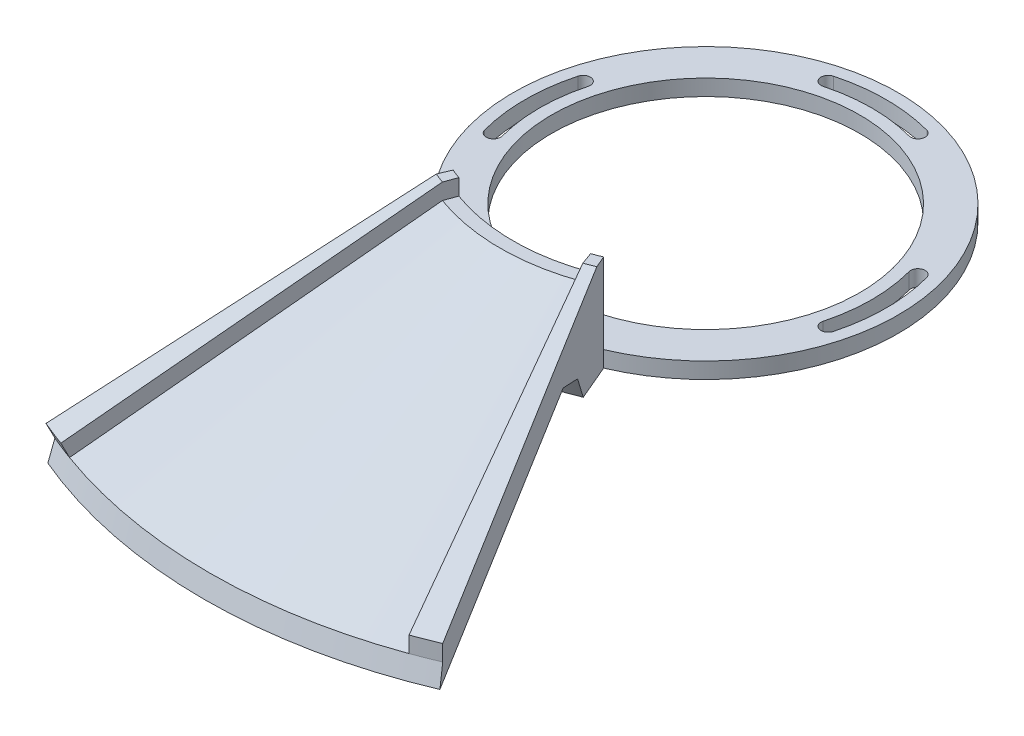
from build123d import *

# Parameters (mm, degrees)
SCHIZZO1_R                   = 60
SCHIZZO1_R_2                 = 48
ESTRUSIONE_ESTRUSIONE1_DEPTH = 5
RIVOLUZIONE1_ANGLE           = 23
RIVOLUZIONE1_OTHER_WAY_ANGLE = 23
RIVOLUZIONE2_ANGLE           = 3
RIVOLUZIONE3_ANGLE           = 3


with BuildPart() as part:
    # Schizzo1 → Estrusione-Estrusione1 (new body)
    with BuildSketch(Plane(origin=(0, 0, 0), x_dir=(1, 0, 0), z_dir=(0, 1, 0))):
        with Locations(Location((0, 0, 0), (0, 0, 270))):
            Circle(SCHIZZO1_R)
        with Locations(Location((0, 0, 0), (0, 0, 270))):
            Circle(SCHIZZO1_R_2, mode=Mode.SUBTRACT)
        with BuildLine():
            ThreePointArc((-14.558571287, -54.333327729), (0, -56.25), (14.558571287, -54.333327729))
            ThreePointArc((14.558571287, -54.333327729), (16.149561545, -51.577651768), (13.393885584, -49.98666151))
            ThreePointArc((13.393885584, -49.98666151), (0, -51.75), (-13.393885584, -49.98666151))
            ThreePointArc((-13.393885584, -49.98666151), (-16.149561545, -51.577651768), (-14.558571287, -54.333327729))
        make_face(mode=Mode.SUBTRACT)
        with BuildLine():
            ThreePointArc((13.393885584, 49.98666151), (16.149561545, 51.577651768), (14.558571287, 54.333327729))
            ThreePointArc((14.558571287, 54.333327729), (0, 56.25), (-14.558571287, 54.333327729))
            ThreePointArc((-14.558571287, 54.333327729), (-16.149561545, 51.577651768), (-13.393885584, 49.98666151))
            ThreePointArc((-13.393885584, 49.98666151), (0, 51.75), (13.393885584, 49.98666151))
        make_face(mode=Mode.SUBTRACT)
        with BuildLine():
            ThreePointArc((49.98666151, -13.393885584), (51.577651768, -16.149561545), (54.333327729, -14.558571287))
            ThreePointArc((54.333327729, -14.558571287), (56.25, 0), (54.333327729, 14.558571287))
            ThreePointArc((54.333327729, 14.558571287), (51.577651768, 16.149561545), (49.98666151, 13.393885584))
            ThreePointArc((49.98666151, 13.393885584), (51.75, 0), (49.98666151, -13.393885584))
        make_face(mode=Mode.SUBTRACT)
        with BuildLine():
            ThreePointArc((-49.98666151, 13.393885584), (-51.577651768, 16.149561545), (-54.333327729, 14.558571287))
            ThreePointArc((-54.333327729, 14.558571287), (-56.25, 0), (-54.333327729, -14.558571287))
            ThreePointArc((-54.333327729, -14.558571287), (-51.577651768, -16.149561545), (-49.98666151, -13.393885584))
            ThreePointArc((-49.98666151, -13.393885584), (-51.75, 0), (-49.98666151, 13.393885584))
        make_face(mode=Mode.SUBTRACT)
    extrude(amount=ESTRUSIONE_ESTRUSIONE1_DEPTH)

    # Schizzo2 → Rivoluzione1 (revolve)
    with BuildSketch(Plane.ZY):
        Polygon((83.801322108, 10.249602265), (156.30594507, -23.559858674), (154.630778704, -17.261826174), (64, 25), (60, 25), (60, 0), (72, 0), (75.34408852, 7.171420975), align=None)
    revolve(axis=Axis((0, 115.29923816, 0), (0, -1, 0)), revolution_arc=RIVOLUZIONE1_ANGLE)

    # Schizzo2 → Rivoluzione1 other way (revolve)
    with BuildSketch(Plane.ZY):
        Polygon((83.801322108, 10.249602265), (156.30594507, -23.559858674), (154.630778704, -17.261826174), (64, 25), (60, 25), (60, 0), (72, 0), (75.34408852, 7.171420975), align=None)
    revolve(axis=Axis((0, 115.29923816, 0), (0, 1, 0)), revolution_arc=RIVOLUZIONE1_OTHER_WAY_ANGLE)

    # Schizzo3 → Rivoluzione2 (revolve)
    with BuildSketch(Plane(origin=(0, 0, 0), x_dir=(-0.39073112848927466, 0, 0.92050485345244), z_dir=(-0.92050485345244, 0, -0.39073112848927466))):
        Polygon((60, 25), (60, 30), (64, 30), (156.743870012, -12.730287239), (154.630778704, -17.261826174), (64, 25), align=None)
    revolve(axis=Axis((0, 115.29923816, 0), (0, 1, 0)), revolution_arc=RIVOLUZIONE2_ANGLE)

    # Schizzo4 → Rivoluzione3 (revolve)
    with BuildSketch(Plane(origin=(0, 0, 0), x_dir=(-0.39073112848927455, 0, -0.92050485345244), z_dir=(0.92050485345244, 0, -0.39073112848927455))):
        Polygon((-60, 25), (-64, 25), (-154.630778704, -17.261826174), (-154.630778704, -12.261826174), (-64, 30), (-60, 30), align=None)
    revolve(axis=Axis((0, 115.29923816, 0), (0, -1, 0)), revolution_arc=RIVOLUZIONE3_ANGLE)


solid = part.part
